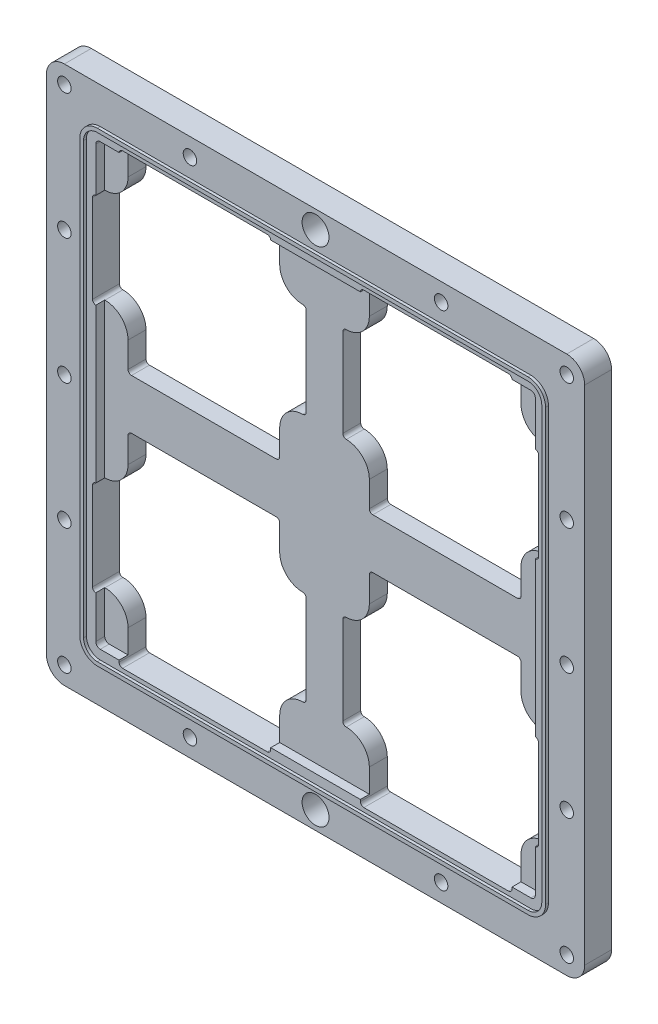
from build123d import *

# Parameters (mm, degrees)
SKETCH1_W            = 190.5
SKETCH1_H            = 190.5
BOSS_EXTRUDE1_DEPTH  = 9.525
SKETCH4_R            = 2.38125
CUT_EXTRUDE1_DEPTH   = 270.576010849
CUT_EXTRUDE3_DEPTH   = 3.175
BOSS_EXTRUDE2_DEPTH  = 1.016
LPATTERN2_COUNT      = 4
LPATTERN2_PITCH      = 44.45
LPATTERN3_COUNT      = 4
LPATTERN3_PITCH      = 44.45
SKETCH7_R            = 4.7625
CUT_EXTRUDE4_DEPTH   = 270.576010849
FILLET1_R            = 6.35
CUT_EXTRUDE5_DEPTH   = 3.175
CUT_EXTRUDE6_DEPTH   = 270.613821383
SKETCH11_R           = 1.3462
CUT_EXTRUDE7_DEPTH   = 4.7625
LPATTERN1_COUNT      = 2
LPATTERN1_PITCH      = 85.3948
LPATTERN1_COUNT_DIR2 = 2
LPATTERN1_PITCH_DIR2 = 88.1634


with BuildPart() as part:
    # Sketch1 → Boss-Extrude1 (new body)
    with BuildSketch(Plane.XY):
        with Locations((95.25, 95.25)):
            Rectangle(SKETCH1_W, SKETCH1_H)
    extrude(amount=BOSS_EXTRUDE1_DEPTH)

    # Sketch4 → Cut-Extrude1 (cut, through all)
    with BuildSketch(Plane.XY.offset(9.525)):
        with Locations((6.35, 6.35)):
            Circle(SKETCH4_R)
        with Locations((6.35, 184.15)):
            Circle(SKETCH4_R)
        with Locations((184.15, 184.15)):
            Circle(SKETCH4_R)
        with Locations((184.15, 6.35)):
            Circle(SKETCH4_R)
    cut_extrude1 = extrude(amount=-CUT_EXTRUDE1_DEPTH, mode=Mode.SUBTRACT)

    # Sketch6 → Cut-Extrude3 (cut)
    with BuildSketch(Plane.XY.offset(9.525)):
        with BuildLine():
            Line((171.45, 173.0375), (19.05, 173.0375))
            ThreePointArc((19.05, 173.0375), (17.927467985, 172.572532015), (17.4625, 171.45))
            Line((17.4625, 171.45), (17.4625, 19.05))
            ThreePointArc((17.4625, 19.05), (17.927467985, 17.927467985), (19.05, 17.4625))
            Line((19.05, 17.4625), (171.45, 17.4625))
            ThreePointArc((171.45, 17.4625), (172.572532015, 17.927467985), (173.0375, 19.05))
            Line((173.0375, 19.05), (173.0375, 171.45))
            ThreePointArc((173.0375, 171.45), (172.572532015, 172.572532015), (171.45, 173.0375))
        make_face()
    extrude(amount=-CUT_EXTRUDE3_DEPTH, mode=Mode.SUBTRACT)

    # Sketch5 → Boss-Extrude2 (add)
    with BuildSketch(Plane.XY.offset(9.525)):
        with BuildLine():
            Line((12.827, 171.45), (12.827, 19.05))
            ThreePointArc((12.827, 19.05), (14.649674501, 14.649674501), (19.05, 12.827))
            Line((19.05, 12.827), (171.45, 12.827))
            ThreePointArc((171.45, 12.827), (175.850325499, 14.649674501), (177.673, 19.05))
            Line((177.673, 19.05), (177.673, 171.45))
            ThreePointArc((177.673, 171.45), (175.850325499, 175.850325499), (171.45, 177.673))
            Line((171.45, 177.673), (19.05, 177.673))
            ThreePointArc((19.05, 177.673), (14.649674501, 175.850325499), (12.827, 171.45))
        make_face()
        with BuildLine():
            ThreePointArc((171.45, 14.1605), (174.907398607, 15.592601393), (176.3395, 19.05))
            Line((176.3395, 19.05), (176.3395, 171.45))
            ThreePointArc((176.3395, 171.45), (174.907398607, 174.907398607), (171.45, 176.3395))
            Line((171.45, 176.3395), (19.05, 176.3395))
            ThreePointArc((19.05, 176.3395), (15.592601393, 174.907398607), (14.1605, 171.45))
            Line((14.1605, 171.45), (14.1605, 19.05))
            ThreePointArc((14.1605, 19.05), (15.592601393, 15.592601393), (19.05, 14.1605))
            Line((19.05, 14.1605), (171.45, 14.1605))
        make_face(mode=Mode.SUBTRACT)
    extrude(amount=BOSS_EXTRUDE2_DEPTH)

    # LPattern2: Cut-Extrude1 ×4
    with Locations(*[(0, -i * LPATTERN2_PITCH, 0) for i in range(1, LPATTERN2_COUNT)]):
        add(cut_extrude1, mode=Mode.SUBTRACT)

    # LPattern3: Cut-Extrude1 ×4
    with Locations(*[(i * LPATTERN3_PITCH, 0, 0) for i in range(1, LPATTERN3_COUNT)]):
        add(cut_extrude1, mode=Mode.SUBTRACT)

    # Sketch7 → Cut-Extrude4 (cut, through all)
    with BuildSketch(Plane.XY.offset(9.525)):
        with Locations((95.25, 6.35)):
            Circle(SKETCH7_R)
        with Locations((95.25, 184.15)):
            Circle(SKETCH7_R)
    extrude(amount=-CUT_EXTRUDE4_DEPTH, mode=Mode.SUBTRACT)

    # Fillet1
    fillet1_edges = [part.edges().sort_by_distance(p)[0] for p in [
        (0, 190.5, 4.7625),
        (190.5, 190.5, 4.7625),
        (190.5, 0, 4.7625),
        (0, 0, 4.7625),
    ]]
    fillet(fillet1_edges, radius=FILLET1_R)

    # Sketch8 → Cut-Extrude5 (cut)
    with BuildSketch(Plane(origin=(0, 0, 0), x_dir=(-1, 0, 0), z_dir=(0, 0, -1))):
        with BuildLine():
            Line((-112.3442, 177.8), (-163.5506, 177.8))
            ThreePointArc((-163.5506, 177.8), (-166.981057838, 176.379057838), (-168.402, 172.9486))
            Line((-168.402, 172.9486), (-168.402, 163.957))
            ThreePointArc((-168.402, 163.957), (-169.733668309, 160.742068309), (-172.9486, 159.4104))
            ThreePointArc((-172.9486, 159.4104), (-176.379057838, 157.989457838), (-177.8, 154.559))
            Line((-177.8, 154.559), (-177.8, 123.3678))
            ThreePointArc((-177.8, 123.3678), (-176.379057838, 119.937342162), (-172.9486, 118.5164))
            ThreePointArc((-172.9486, 118.5164), (-169.733668309, 117.184731691), (-168.402, 113.9698))
            Line((-168.402, 113.9698), (-168.402, 104.9782))
            ThreePointArc((-168.402, 104.9782), (-166.981057838, 101.547742162), (-163.5506, 100.1268))
            Line((-163.5506, 100.1268), (-112.3442, 100.1268))
            ThreePointArc((-112.3442, 100.1268), (-108.913742162, 101.547742162), (-107.4928, 104.9782))
            Line((-107.4928, 104.9782), (-107.4928, 113.9698))
            ThreePointArc((-107.4928, 113.9698), (-106.161131691, 117.184731691), (-102.9462, 118.5164))
            ThreePointArc((-102.9462, 118.5164), (-99.515742162, 119.937342162), (-98.0948, 123.3678))
            Line((-98.0948, 123.3678), (-98.0948, 154.559))
            ThreePointArc((-98.0948, 154.559), (-99.515742162, 157.989457838), (-102.9462, 159.4104))
            ThreePointArc((-102.9462, 159.4104), (-106.161131691, 160.742068309), (-107.4928, 163.957))
            Line((-107.4928, 163.957), (-107.4928, 172.9486))
            ThreePointArc((-107.4928, 172.9486), (-108.913742162, 176.379057838), (-112.3442, 177.8))
        make_face()
        with BuildLine():
            Line((-175.768, 154.559), (-175.768, 123.3678))
            ThreePointArc((-175.768, 123.3678), (-174.942216859, 121.374183141), (-172.9486, 120.5484))
            ThreePointArc((-172.9486, 120.5484), (-168.296827329, 118.621572671), (-166.37, 113.9698))
            Line((-166.37, 113.9698), (-166.37, 104.9782))
            ThreePointArc((-166.37, 104.9782), (-165.544216859, 102.984583141), (-163.5506, 102.1588))
            Line((-163.5506, 102.1588), (-112.3442, 102.1588))
            ThreePointArc((-112.3442, 102.1588), (-110.350583141, 102.984583141), (-109.5248, 104.9782))
            Line((-109.5248, 104.9782), (-109.5248, 113.9698))
            ThreePointArc((-109.5248, 113.9698), (-107.597972671, 118.621572671), (-102.9462, 120.5484))
            ThreePointArc((-102.9462, 120.5484), (-100.952583141, 121.374183141), (-100.1268, 123.3678))
            Line((-100.1268, 123.3678), (-100.1268, 154.559))
            ThreePointArc((-100.1268, 154.559), (-100.952583141, 156.552616859), (-102.9462, 157.3784))
            ThreePointArc((-102.9462, 157.3784), (-107.597972671, 159.305227329), (-109.5248, 163.957))
            Line((-109.5248, 163.957), (-109.5248, 172.9486))
            ThreePointArc((-109.5248, 172.9486), (-110.350583141, 174.942216859), (-112.3442, 175.768))
            Line((-112.3442, 175.768), (-163.5506, 175.768))
            ThreePointArc((-163.5506, 175.768), (-165.544216859, 174.942216859), (-166.37, 172.9486))
            Line((-166.37, 172.9486), (-166.37, 163.957))
            ThreePointArc((-166.37, 163.957), (-168.296827329, 159.305227329), (-172.9486, 157.3784))
            ThreePointArc((-172.9486, 157.3784), (-174.942216859, 156.552616859), (-175.768, 154.559))
        make_face(mode=Mode.SUBTRACT)
    cut_extrude5 = extrude(amount=-CUT_EXTRUDE5_DEPTH, mode=Mode.SUBTRACT)

    # Sketch10 → Cut-Extrude6 (cut, through all)
    with BuildSketch(Plane(origin=(0, 0, 0), x_dir=(-1, 0, 0), z_dir=(0, 0, -1))):
        with BuildLine():
            Line((-174.1805, 154.559), (-174.1805, 123.3678))
            ThreePointArc((-174.1805, 123.3678), (-173.819684844, 122.496715156), (-172.9486, 122.1359))
            ThreePointArc((-172.9486, 122.1359), (-167.174295314, 119.744104686), (-164.7825, 113.9698))
            Line((-164.7825, 113.9698), (-164.7825, 104.9782))
            ThreePointArc((-164.7825, 104.9782), (-164.421684844, 104.107115156), (-163.5506, 103.7463))
            Line((-163.5506, 103.7463), (-112.3442, 103.7463))
            ThreePointArc((-112.3442, 103.7463), (-111.473115156, 104.107115156), (-111.1123, 104.9782))
            Line((-111.1123, 104.9782), (-111.1123, 113.9698))
            ThreePointArc((-111.1123, 113.9698), (-108.720504686, 119.744104686), (-102.9462, 122.1359))
            ThreePointArc((-102.9462, 122.1359), (-102.075115156, 122.496715156), (-101.7143, 123.3678))
            Line((-101.7143, 123.3678), (-101.7143, 154.559))
            ThreePointArc((-101.7143, 154.559), (-102.075115156, 155.430084844), (-102.9462, 155.7909))
            ThreePointArc((-102.9462, 155.7909), (-108.720504686, 158.182695314), (-111.1123, 163.957))
            Line((-111.1123, 163.957), (-111.1123, 172.9486))
            ThreePointArc((-111.1123, 172.9486), (-111.473115156, 173.819684844), (-112.3442, 174.1805))
            Line((-112.3442, 174.1805), (-163.5506, 174.1805))
            ThreePointArc((-163.5506, 174.1805), (-164.421684844, 173.819684844), (-164.7825, 172.9486))
            Line((-164.7825, 172.9486), (-164.7825, 163.957))
            ThreePointArc((-164.7825, 163.957), (-167.174295314, 158.182695314), (-172.9486, 155.7909))
            ThreePointArc((-172.9486, 155.7909), (-173.819684844, 155.430084844), (-174.1805, 154.559))
        make_face()
    cut_extrude6 = extrude(amount=-CUT_EXTRUDE6_DEPTH, mode=Mode.SUBTRACT)

    # Sketch11 → Cut-Extrude7 (cut)
    with BuildSketch(Plane(origin=(0, 0, 0), x_dir=(-1, 0, 0), z_dir=(0, 0, -1))):
        with Locations((-172.9486, 172.9994)):
            Circle(SKETCH11_R)
        with Locations((-102.9462, 172.9994)):
            Circle(SKETCH11_R)
        with Locations((-102.9462, 104.9274)):
            Circle(SKETCH11_R)
        with Locations((-172.9486, 104.9274)):
            Circle(SKETCH11_R)
    cut_extrude7 = extrude(amount=-CUT_EXTRUDE7_DEPTH, mode=Mode.SUBTRACT)

    # LPattern1: Cut-Extrude5, Cut-Extrude6, Cut-Extrude7 2 × 2
    with Locations(*[(-i * LPATTERN1_PITCH, -j * LPATTERN1_PITCH_DIR2, 0) for i in range(LPATTERN1_COUNT) for j in range(LPATTERN1_COUNT_DIR2) if (i, j) != (0, 0)]):
        add(cut_extrude5, mode=Mode.SUBTRACT)
        add(cut_extrude6, mode=Mode.SUBTRACT)
        add(cut_extrude7, mode=Mode.SUBTRACT)


solid = part.part
